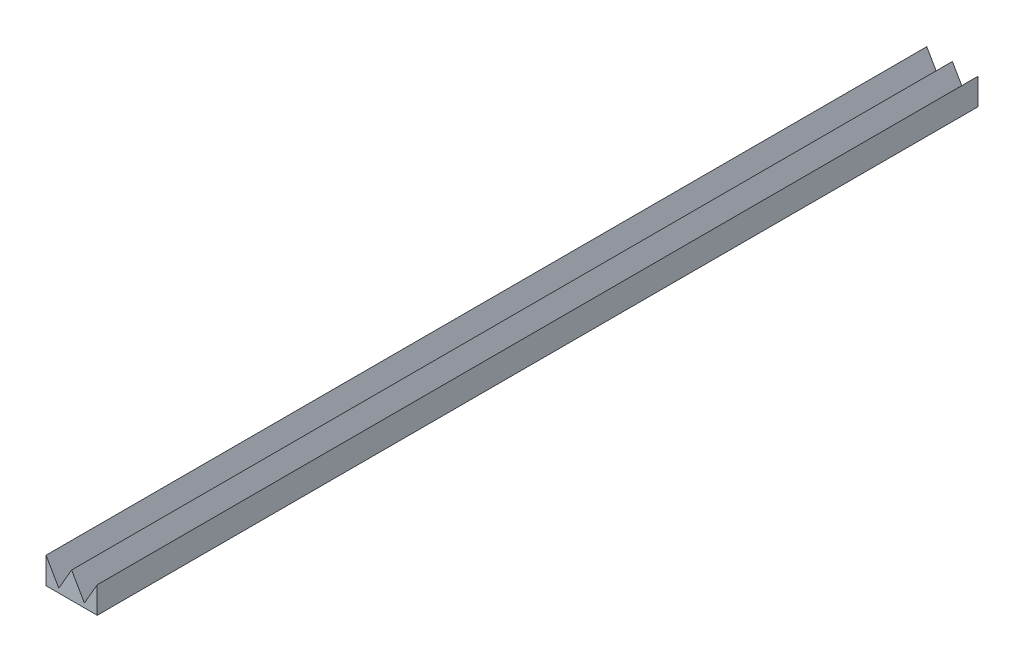
from build123d import *

# Parameters (mm, degrees)
BOSS_EXTRUDE1_DEPTH = 172


with BuildPart() as part:
    # Sketch1 → Boss-Extrude1 (new body)
    with BuildSketch(Plane.XY):
        Polygon((0, 0), (0, 5.165063509), (2.5, 0.834936491), (5, 5.165063509), (7.5, 0.834936491), (10, 5.165063509), (10, 0), align=None)
    extrude(amount=BOSS_EXTRUDE1_DEPTH)


solid = part.part
